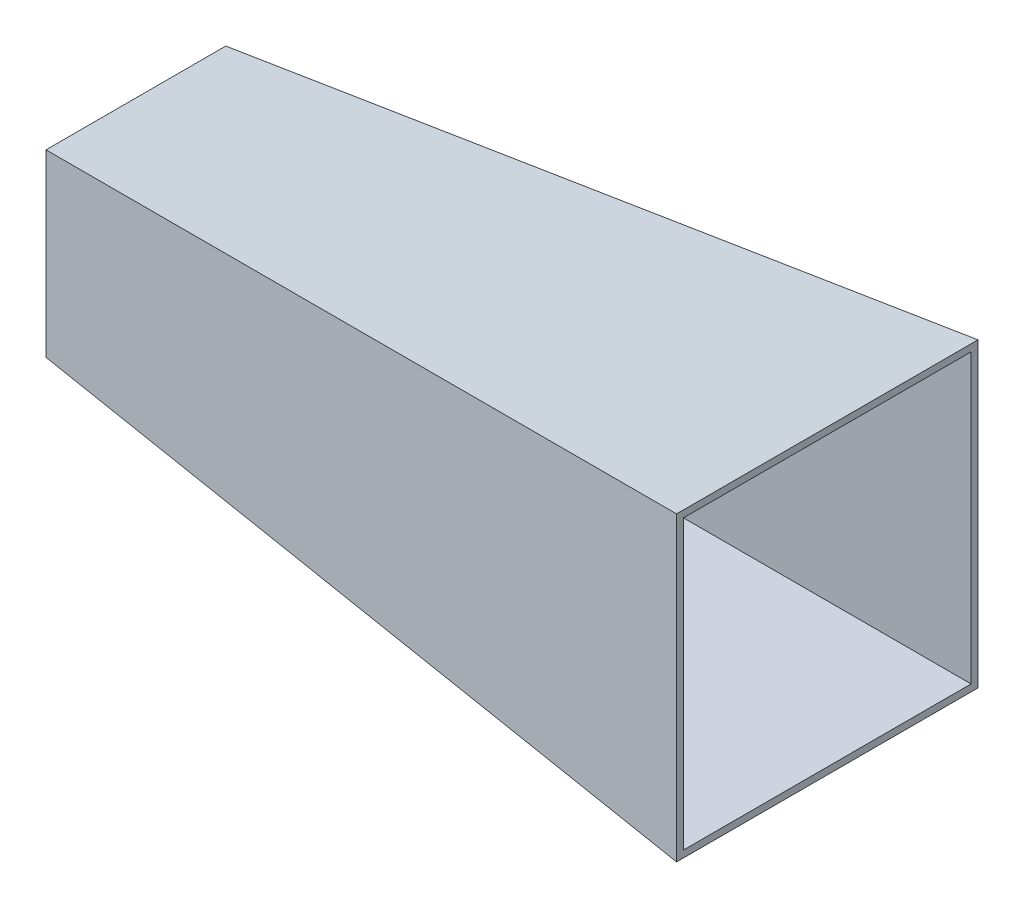
from build123d import *


with BuildPart() as part:
    # Sketch1 → Loft1 section 0
    with BuildSketch(Plane(origin=(0, 0, 0), x_dir=(0, 0, -1), z_dir=(1, 0, 0))):
        with BuildLine():
            Line((-65, 65), (65, 65))
            Line((65, 65), (65, -65))
            Line((65, -65), (-65, -65))
            Line((-65, -65), (-65, 65))
        make_face()
    # Sketch2 → Loft1 section 1
    with BuildSketch(Plane(origin=(500, 0, 0), x_dir=(0, 0, -1), z_dir=(1, 0, 0))):
        with BuildLine():
            Line((-109, 109), (109, 109))
            Line((109, 109), (109, -109))
            Line((109, -109), (-109, -109))
            Line((-109, -109), (-109, 109))
        make_face()
    loft()

    # Sketch1<3> → Cut-Loft1 section 0
    with BuildSketch(Plane(origin=(0, 0, 0), x_dir=(0, 0, -1), z_dir=(1, 0, 0))):
        with BuildLine():
            Line((-60, 60), (60, 60))
            Line((60, 60), (60, -60))
            Line((60, -60), (-60, -60))
            Line((-60, -60), (-60, 60))
        make_face()
    # Sketch2<3> → Cut-Loft1 section 1
    with BuildSketch(Plane(origin=(500, 0, 0), x_dir=(0, 0, -1), z_dir=(1, 0, 0))):
        with BuildLine():
            Line((-104, 104), (104, 104))
            Line((104, 104), (104, -104))
            Line((104, -104), (-104, -104))
            Line((-104, -104), (-104, 104))
        make_face()
    loft(mode=Mode.SUBTRACT)


solid = part.part
